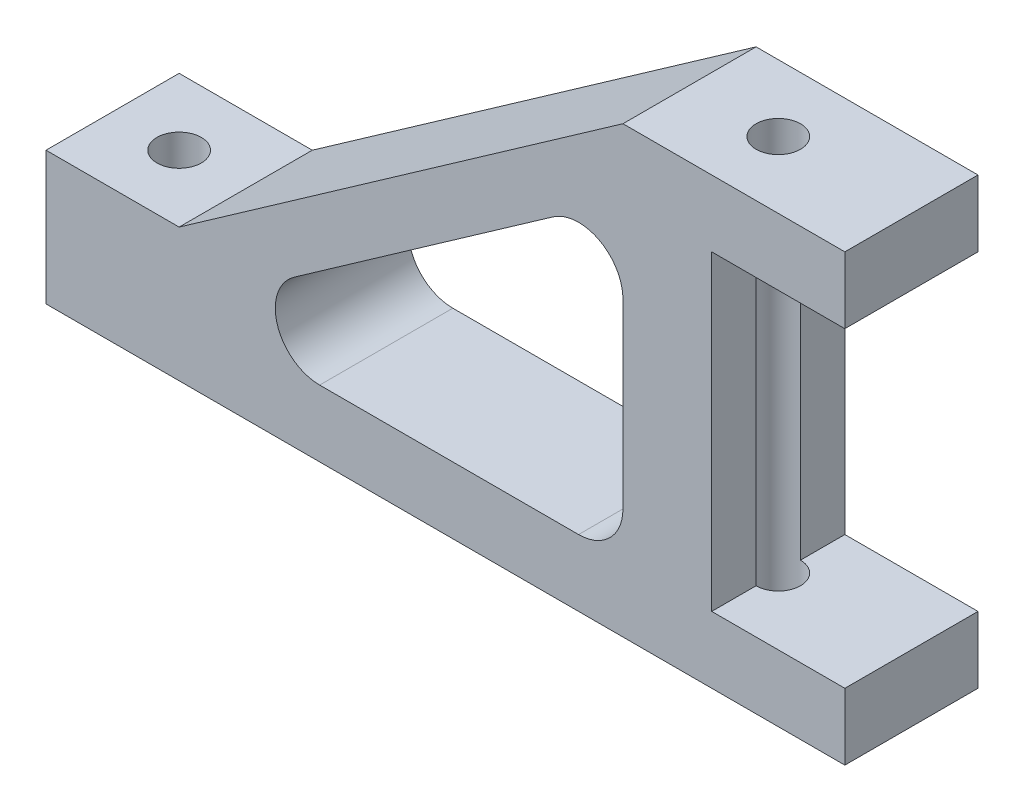
from build123d import *

# Parameters (mm, degrees)
BOSS_EXTRUDE1_DEPTH = 30
SKETCH2_R           = 5
CUT_EXTRUDE1_DEPTH  = 90


with BuildPart() as part:
    # Sketch1 → Boss-Extrude1 (new body)
    with BuildSketch(Plane.XY):
        Polygon((-77.503184713, 15), (-77.503184713, -15), (102.496815287, -15), (102.496815287, 0), (72.496815287, 0), (72.496815287, 70.165605096), (102.496815287, 70.165605096), (102.496815287, 85.165605096), (52.496815287, 85.165605096), (-47.503184713, 15), align=None)
        with BuildLine():
            Line((52.496815287, 50.932984608), (52.496815287, 10))
            ThreePointArc((52.496815287, 10), (49.567883098, 2.928932188), (42.496815287, 0))
            Line((42.496815287, 0), (-15.840862486, 0))
            ThreePointArc((-15.840862486, 0), (-25.376570483, 6.988310608), (-21.58458061, 18.185945401))
            Line((-21.58458061, 18.185945401), (36.753097163, 59.11893001))
            ThreePointArc((36.753097163, 59.11893001), (47.109993083, 59.805334388), (52.496815287, 50.932984608))
        make_face(mode=Mode.SUBTRACT)
    extrude(amount=BOSS_EXTRUDE1_DEPTH)

    # Sketch2 → Cut-Extrude1 (cut, symmetric)
    with BuildSketch(Plane(origin=(0, 15, 0), x_dir=(1, 0, 0), z_dir=(0, 1, 0))):
        with Locations(Location((-62.503184713, -15, 0), (0, 0, 270))):
            Circle(SKETCH2_R)
        with Locations(Location((72.496815287, -15, 0), (0, 0, 270))):
            Circle(SKETCH2_R)
    extrude(amount=CUT_EXTRUDE1_DEPTH, both=True, mode=Mode.SUBTRACT)


solid = part.part
